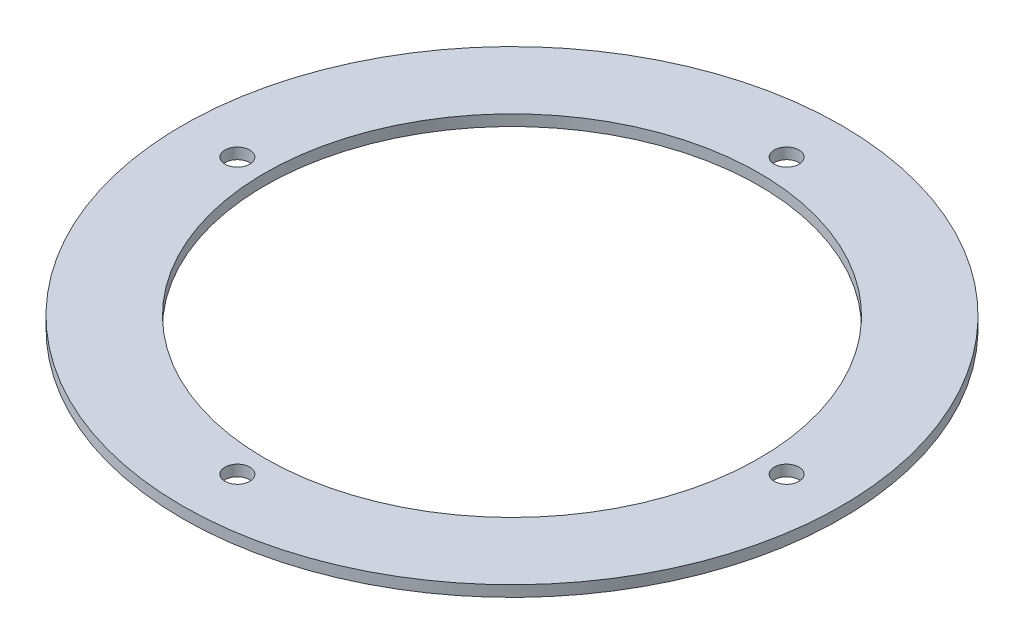
from build123d import *

# Parameters (mm, degrees)
SKETCH1_R           = 60
SKETCH1_R_2         = 45
SKETCH1_R_3         = 2.25
BOSS_EXTRUDE1_DEPTH = 2


with BuildPart() as part:
    # Sketch1 → Boss-Extrude1 (new body)
    with BuildSketch(Plane(origin=(0, 0, 0), x_dir=(1, 0, 0), z_dir=(0, 1, 0))):
        with Locations(Location((0, 0, 0), (0, 0, 270))):
            Circle(SKETCH1_R)
        with Locations(Location((0, 0, 0), (0, 0, 270))):
            Circle(SKETCH1_R_2, mode=Mode.SUBTRACT)
        with Locations(Location((0, 50, 0), (0, 0, 270))):
            Circle(SKETCH1_R_3, mode=Mode.SUBTRACT)
        with Locations(Location((50, 0, 0), (0, 0, 270))):
            Circle(SKETCH1_R_3, mode=Mode.SUBTRACT)
        with Locations(Location((0, -50, 0), (0, 0, 270))):
            Circle(SKETCH1_R_3, mode=Mode.SUBTRACT)
        with Locations(Location((-50, 0, 0), (0, 0, 270))):
            Circle(SKETCH1_R_3, mode=Mode.SUBTRACT)
    extrude(amount=BOSS_EXTRUDE1_DEPTH)


solid = part.part
